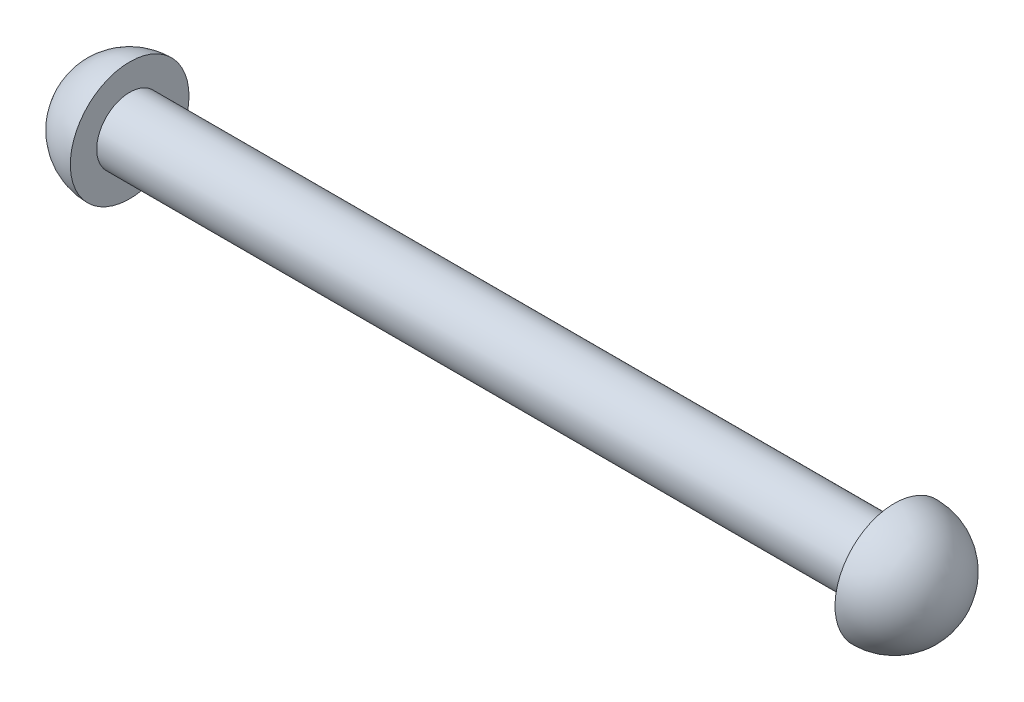
from build123d import *


with BuildPart() as part:
    # Sketch1 → Revolve1 (revolve)
    with BuildSketch(Plane.XY, mode=Mode.PRIVATE) as revolve1_sk:
        with BuildLine():
            Line((-36.83, 3.175), (36.83, 3.175))
            Line((36.83, 3.175), (36.83, 5.715))
            ThreePointArc((36.83, 5.715), (40.871115254, 4.041115254), (42.545, 0))
            Line((42.545, 0), (-42.545, 0))
            ThreePointArc((-42.545, 0), (-40.871115254, 4.041115254), (-36.83, 5.715))
            Line((-36.83, 5.715), (-36.83, 3.175))
        make_face()
    revolve(revolve1_sk.sketch.rotate(Axis((42.545, 0, 0), (-1, 0, 0)), 90), axis=Axis((42.545, 0, 0), (-1, 0, 0)))


solid = part.part
